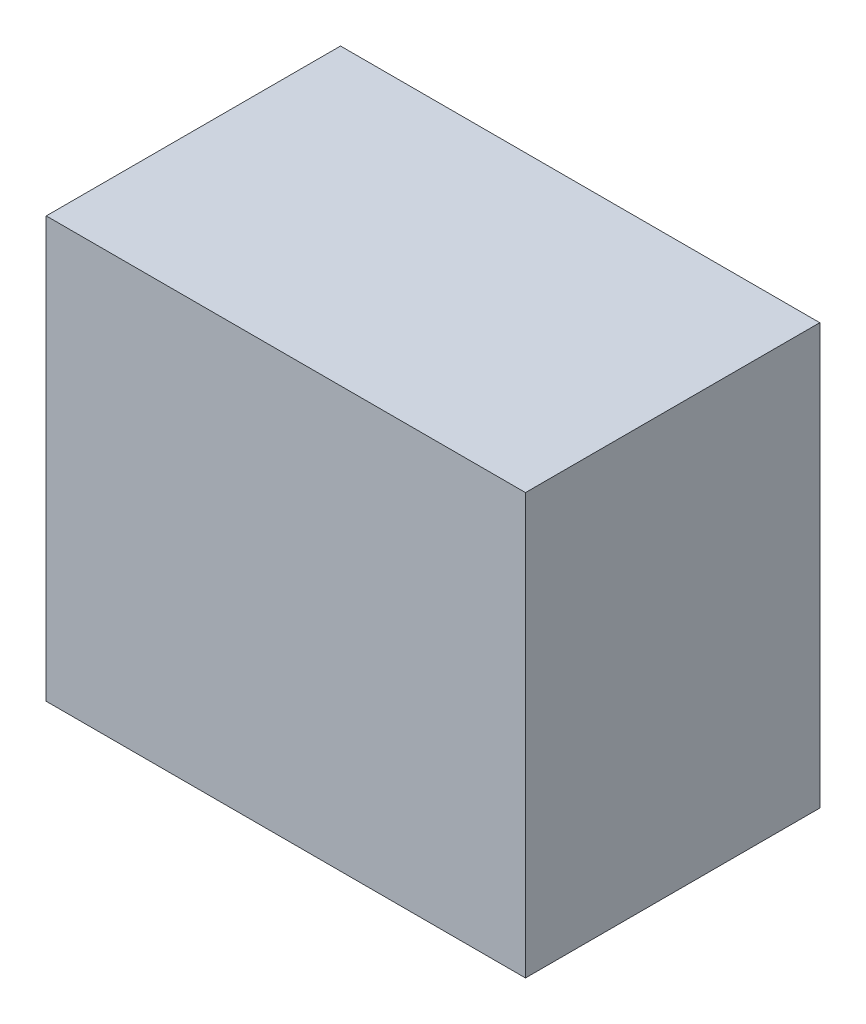
from build123d import *

# Parameters (mm, degrees)
SKETCH1_W           = 57
SKETCH1_H           = 35
BOSS_EXTRUDE1_DEPTH = 50
SKETCH3_W           = 55
SKETCH3_H           = 33
CUT_EXTRUDE1_DEPTH  = 48


with BuildPart() as part:
    # Sketch1 → Boss-Extrude1 (new body)
    with BuildSketch(Plane(origin=(0, 0, 0), x_dir=(1, 0, 0), z_dir=(0, 1, 0))):
        Rectangle(SKETCH1_W, SKETCH1_H)
    extrude(amount=BOSS_EXTRUDE1_DEPTH)

    # Sketch3 → Cut-Extrude1 (cut)
    with BuildSketch(Plane(origin=(0, 1, 0), x_dir=(1, 0, 0), z_dir=(0, 1, 0))):
        Rectangle(SKETCH3_W, SKETCH3_H)
    extrude(amount=CUT_EXTRUDE1_DEPTH, mode=Mode.SUBTRACT)


solid = part.part
